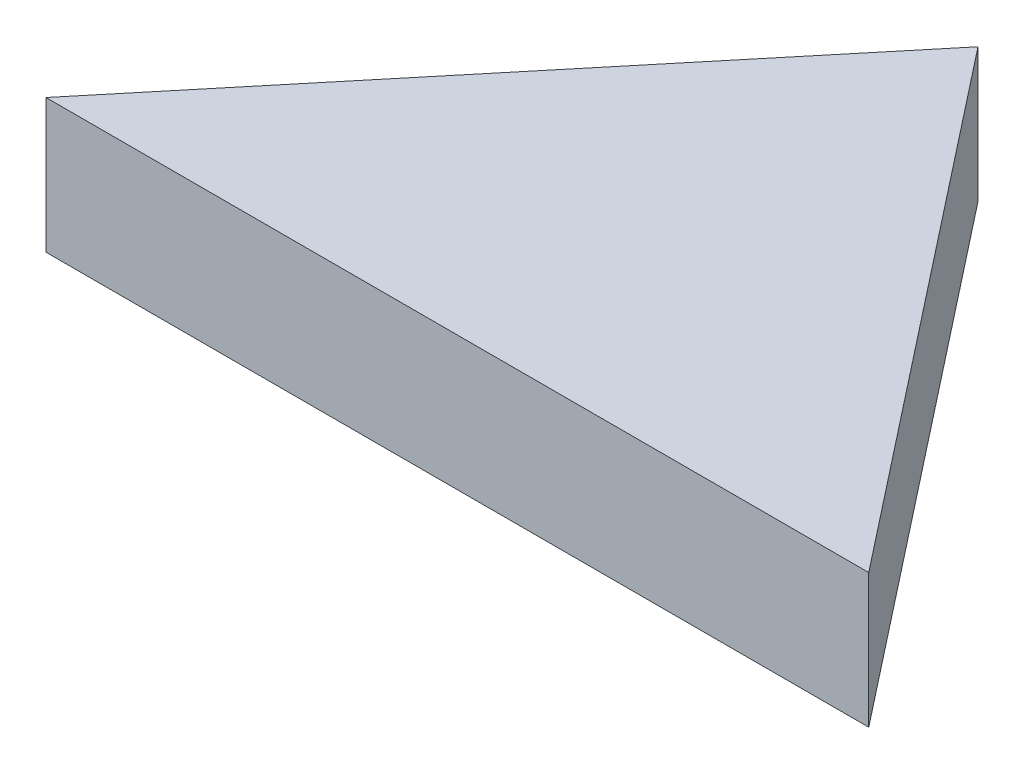
from build123d import *

# Parameters (mm, degrees)
BOSS_EXTRUDE1_DEPTH = 1


with BuildPart() as part:
    # Sketch1 → Boss-Extrude1 (new body)
    with BuildSketch(Plane(origin=(0, 0, 0), x_dir=(1, 0, 0), z_dir=(0, 1, 0))):
        Polygon((0, 0), (3.149641694, 3.805700619), (6.14, 0), align=None)
    extrude(amount=BOSS_EXTRUDE1_DEPTH)


solid = part.part
